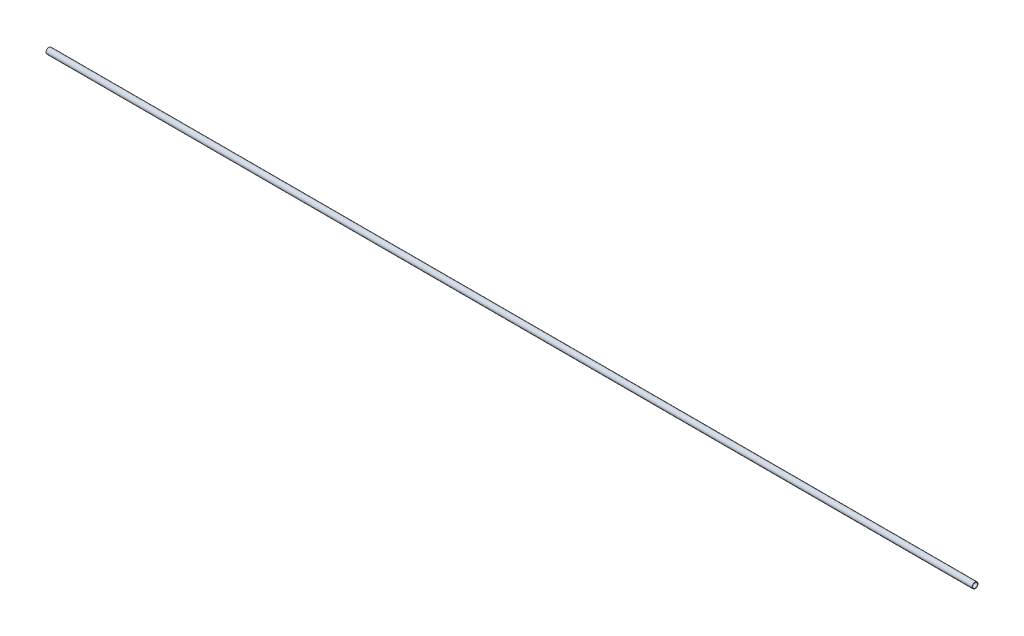
from build123d import *

# Parameters (mm, degrees)
SKETCH1_R           = 3.81
BOSS_EXTRUDE1_DEPTH = 1219.2
SKETCH2_R           = 3.175
CUT_EXTRUDE1_DEPTH  = 1220.211906192


with BuildPart() as part:
    # Sketch1 → Boss-Extrude1 (new body)
    with BuildSketch(Plane(origin=(0, 0, 0), x_dir=(0, 0, -1), z_dir=(1, 0, 0))):
        with Locations(Location((0, 0, 0), (0, 0, 180))):
            Circle(SKETCH1_R)
    extrude(amount=BOSS_EXTRUDE1_DEPTH)

    # Sketch2 → Cut-Extrude1 (cut, through all)
    with BuildSketch(Plane.ZY):
        Circle(SKETCH2_R)
    extrude(amount=-CUT_EXTRUDE1_DEPTH, mode=Mode.SUBTRACT)


solid = part.part
